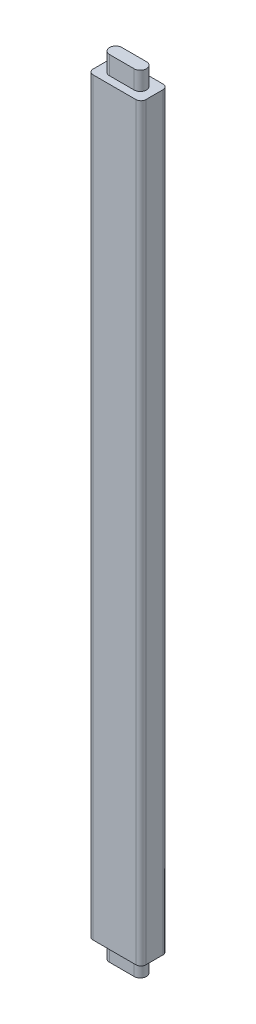
from build123d import *

# Parameters (mm, degrees)
ESQUISSE1_W        = 43
ESQUISSE1_H        = 22
BOSS_EXTRU_1_DEPTH = 610
BOSS_EXTRU_2_DEPTH = 15
BOSS_EXTRU_3_START = -625
BOSS_EXTRU_3_DEPTH = 15
CONG_1_R           = 4


with BuildPart() as part:
    # Esquisse1 → Boss.-Extru.1 (new body)
    with BuildSketch(Plane(origin=(0, 0, 0), x_dir=(1, 0, 0), z_dir=(0, 1, 0))):
        with Locations((21.5, 11)):
            Rectangle(ESQUISSE1_W, ESQUISSE1_H)
    extrude(amount=BOSS_EXTRU_1_DEPTH)

    # Esquisse2 → Boss.-Extru.2 (add)
    with BuildSketch(Plane(origin=(0, 610, 0), x_dir=(1, 0, 0), z_dir=(0, 1, 0))):
        with BuildLine():
            Line((11.5, 16), (31.5, 16))
            ThreePointArc((31.5, 16), (36.5, 11), (31.5, 6))
            Line((31.5, 6), (11.5, 6))
            ThreePointArc((11.5, 6), (6.5, 11), (11.5, 16))
        make_face()
    extrude(amount=BOSS_EXTRU_2_DEPTH)

    # Esquisse2<2> → Boss.-Extru.3 (add)
    with BuildSketch(Plane(origin=(0, 610, 0), x_dir=(1, 0, 0), z_dir=(0, 1, 0)).offset(BOSS_EXTRU_3_START)):
        with BuildLine():
            Line((11.5, 16), (31.5, 16))
            ThreePointArc((31.5, 16), (36.5, 11), (31.5, 6))
            Line((31.5, 6), (11.5, 6))
            ThreePointArc((11.5, 6), (6.5, 11), (11.5, 16))
        make_face()
    extrude(amount=BOSS_EXTRU_3_DEPTH)

    # Congé1
    cong_1_edges = [part.edges().sort_by_distance(p)[0] for p in [
        (0, 305, -22),
        (43, 305, -22),
        (43, 305, 0),
        (0, 305, 0),
    ]]
    fillet(cong_1_edges, radius=CONG_1_R)


solid = part.part
